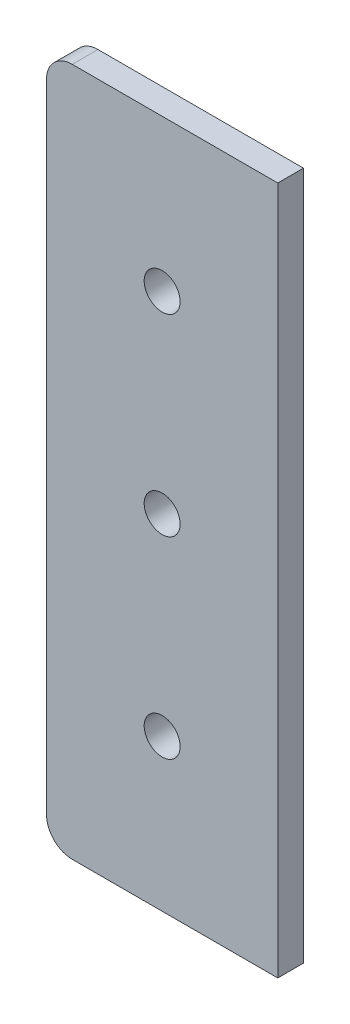
from build123d import *

# Parameters (mm, degrees)
SKETCH1_R           = 7
BOSS_EXTRUDE1_DEPTH = 10


with BuildPart() as part:
    # Sketch1 → Boss-Extrude1 (new body)
    with BuildSketch(Plane.XY):
        with BuildLine():
            Line((-63.333523535, 182.443481279), (-143.333523535, 182.443481279))
            ThreePointArc((-143.333523535, 182.443481279), (-150.404591346, 179.514549091), (-153.333523535, 172.443481279))
            Line((-153.333523535, 172.443481279), (-153.333523535, -75.556518721))
            ThreePointArc((-153.333523535, -75.556518721), (-150.404591346, -82.627586533), (-143.333523535, -85.556518721))
            Line((-143.333523535, -85.556518721), (-63.333523535, -85.556518721))
            Line((-63.333523535, -85.556518721), (-63.333523535, 182.443481279))
        make_face()
        with Locations((-108.333523535, 48.443481279)):
            Circle(SKETCH1_R, mode=Mode.SUBTRACT)
        with Locations((-108.333523535, 123.443481279)):
            Circle(SKETCH1_R, mode=Mode.SUBTRACT)
        with Locations((-108.333523535, -26.556518721)):
            Circle(SKETCH1_R, mode=Mode.SUBTRACT)
    extrude(amount=BOSS_EXTRUDE1_DEPTH)


solid = part.part
